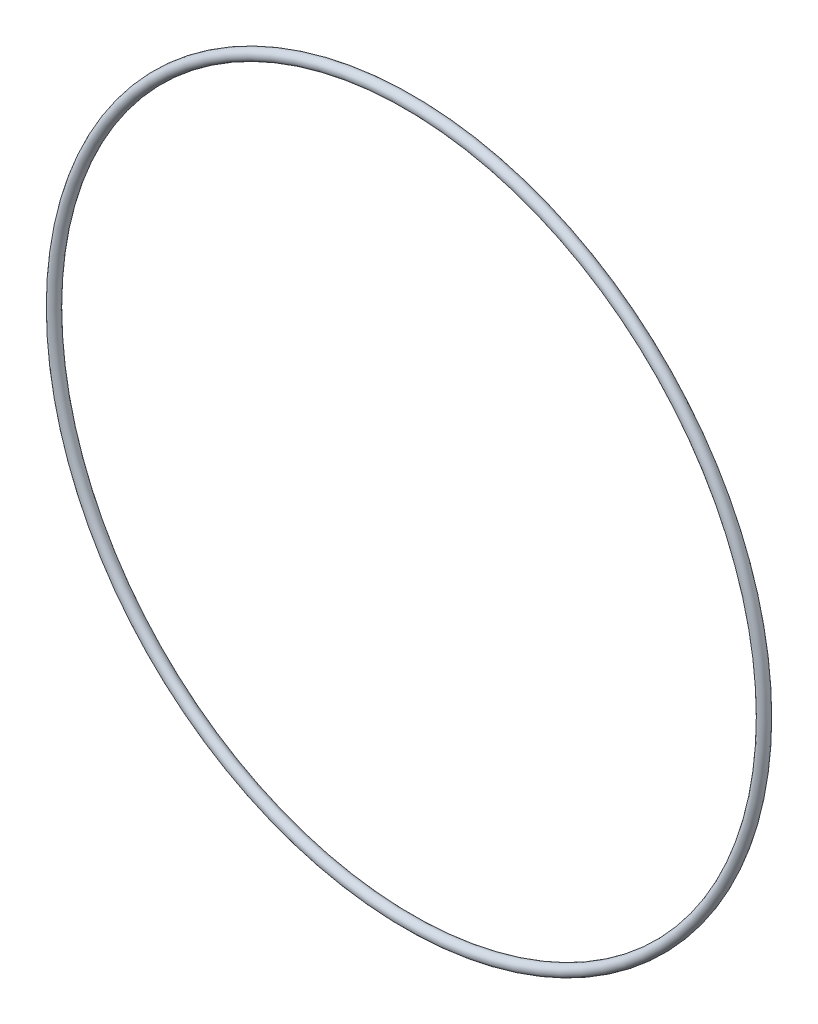
from build123d import *

# Parameters (mm, degrees)
SKETCH1_R = 0.889


with BuildPart() as part:
    # Sketch1 → Revolve1 (revolve)
    with BuildSketch(Plane(origin=(0, 0, 0), x_dir=(0, -1, 0), z_dir=(1, 0, 0)), mode=Mode.PRIVATE) as revolve1_sk:
        with Locations((57.8993, 0)):
            Circle(SKETCH1_R)
    revolve(revolve1_sk.sketch.rotate(Axis((0, 0, 0.889), (0, 0, -1)), 270), axis=Axis((0, 0, 0.889), (0, 0, -1)))


solid = part.part
